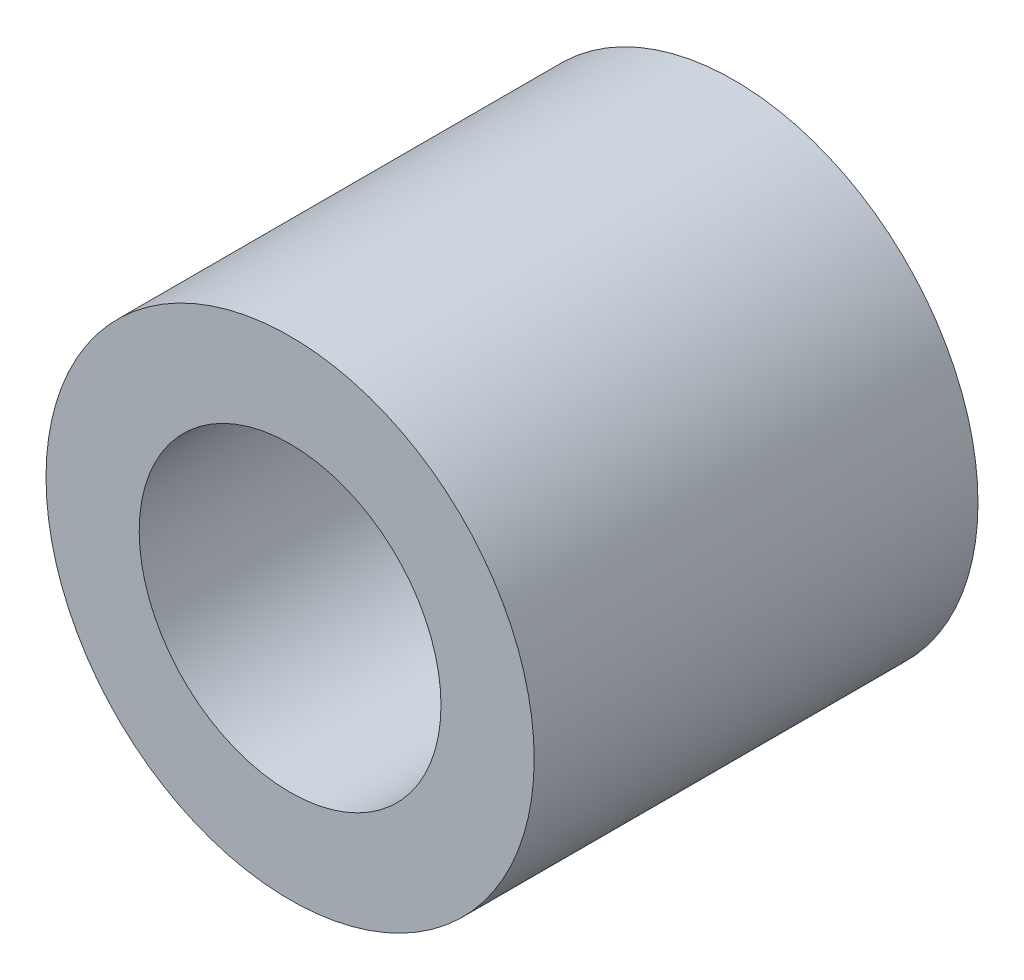
from build123d import *

# Parameters (mm, degrees)
SKETCH_1_R      = 2.75
SKETCH_1_R_2    = 1.7
EXTRUDE_1_DEPTH = 5


with BuildPart() as part:
    # 草图1 → 凸台-拉伸1 (new body)
    with BuildSketch(Plane.XY):
        Circle(SKETCH_1_R)
        Circle(SKETCH_1_R_2, mode=Mode.SUBTRACT)
    extrude(amount=EXTRUDE_1_DEPTH)


solid = part.part
